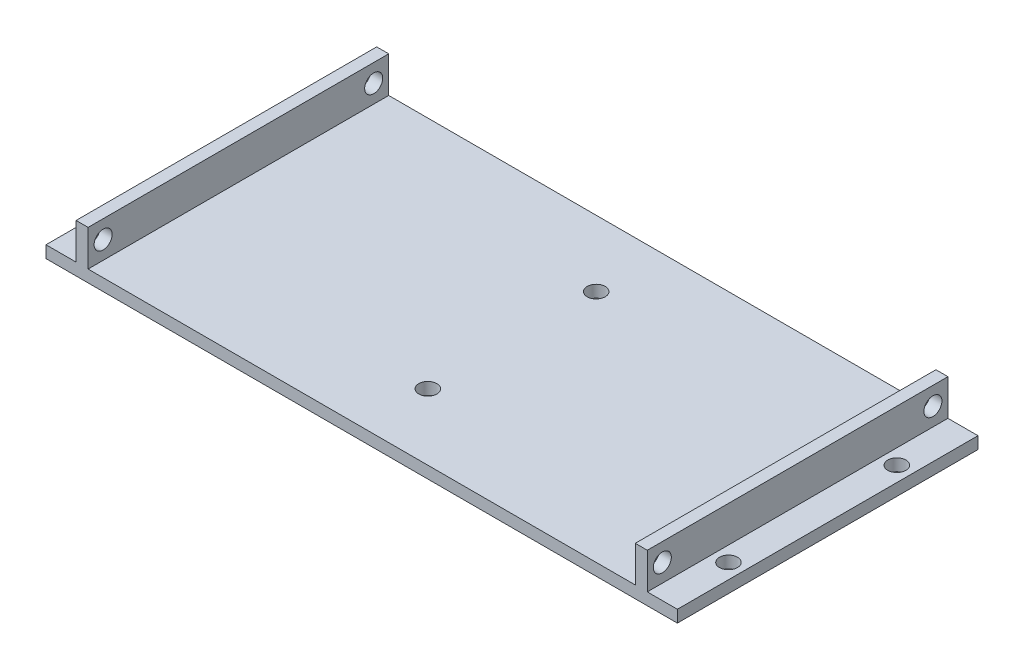
from build123d import *

# Parameters (mm, degrees)
SKETCH_1_W          = 105
SKETCH_1_H          = 50
EXTRUDE_1_DEPTH     = 2
SKETCH_6_W          = 2
SKETCH_6_H          = 50
EXTRUDE_3_DEPTH     = 6
SKETCH_7_R          = 1.5
CUT_EXTRUDE_3_DEPTH = 6
SKETCH_8_R          = 1.5
CUT_EXTRUDE_4_DEPTH = 100


with BuildPart() as part:
    # 草图1 → 凸台-拉伸1 (new body)
    with BuildSketch(Plane(origin=(0, 0, 0), x_dir=(1, 0, 0), z_dir=(0, 1, 0))):
        Rectangle(SKETCH_1_W, SKETCH_1_H)
    extrude(amount=EXTRUDE_1_DEPTH)

    # 草图6 → 凸台-拉伸3 (add)
    with BuildSketch(Plane(origin=(0, 2, 0), x_dir=(1, 0, 0), z_dir=(0, 1, 0))):
        with Locations((-46.5, 0)):
            Rectangle(SKETCH_6_W, SKETCH_6_H)
        with Locations((46.5, 0)):
            Rectangle(SKETCH_6_W, SKETCH_6_H)
    extrude(amount=EXTRUDE_3_DEPTH)

    # 草图7 → 切除-拉伸3 (cut)
    with BuildSketch(Plane(origin=(0, 2, 0), x_dir=(1, 0, 0), z_dir=(0, 1, 0))):
        with Locations(Location((-50, 14, 0), (0, 0, 270))):
            Circle(SKETCH_7_R)
        with Locations(Location((-50, -14, 0), (0, 0, 270))):
            Circle(SKETCH_7_R)
        with Locations(Location((50, 14, 0), (0, 0, 270))):
            Circle(SKETCH_7_R)
        with Locations(Location((50, -14, 0), (0, 0, 270))):
            Circle(SKETCH_7_R)
        with Locations(Location((0, 14, 0), (0, 0, 270))):
            Circle(SKETCH_7_R)
        with Locations(Location((0, -14, 0), (0, 0, 270))):
            Circle(SKETCH_7_R)
    extrude(amount=-CUT_EXTRUDE_3_DEPTH, mode=Mode.SUBTRACT)

    # 草图8 → 切除-拉伸4 (cut)
    with BuildSketch(Plane.ZY.offset(47.5)):
        with Locations((-22.5, 5)):
            Circle(SKETCH_8_R)
        with Locations((22.5, 5)):
            Circle(SKETCH_8_R)
    extrude(amount=-CUT_EXTRUDE_4_DEPTH, mode=Mode.SUBTRACT)


solid = part.part
